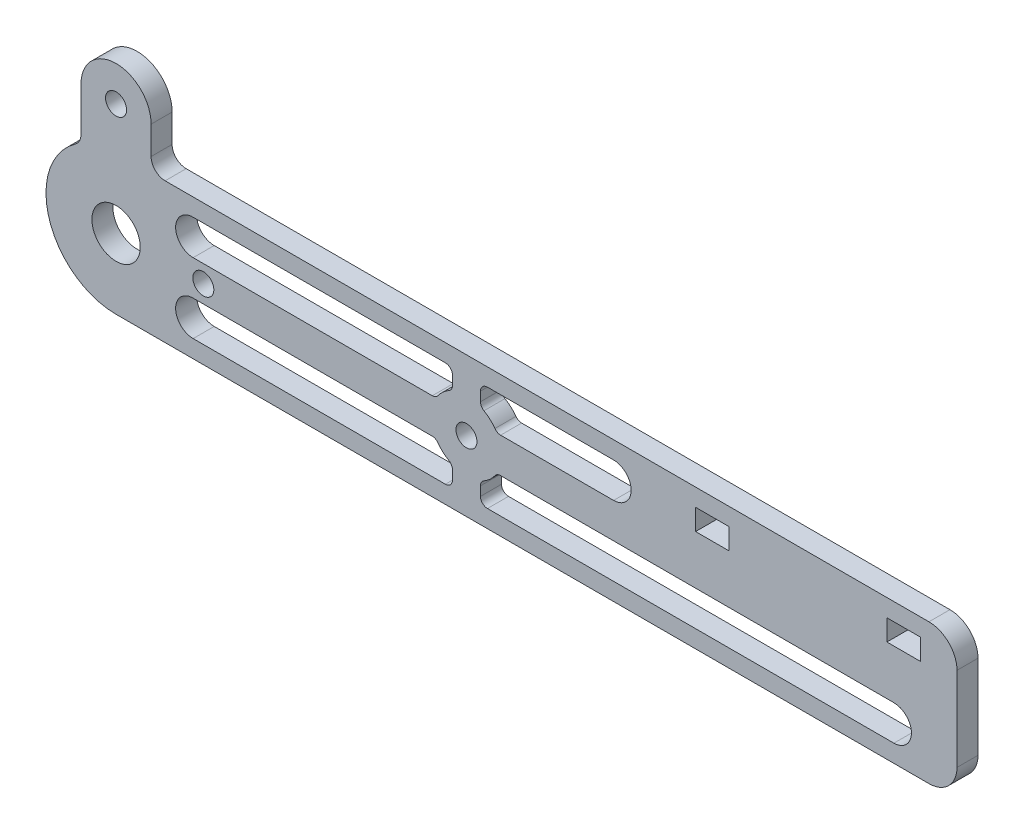
from build123d import *

# Parameters (mm, degrees)
BOSS_EXTRUDE1_DEPTH = 3
CUT_EXTRUDE1_REACH  = 122.453
SKETCH2_R           = 3.45
FILLET1_R           = 4
CUT_EXTRUDE2_REACH  = 122.453
SKETCH3_W           = 4.8
SKETCH3_H           = 3
CUT_EXTRUDE3_REACH  = 122.453
SKETCH5_R           = 1.5
BOSS_EXTRUDE2_DEPTH = 3
CUT_EXTRUDE4_REACH  = 122.453
SKETCH5_3_R         = 1.5
FILLET2_R           = 1
CUT_EXTRUDE5_REACH  = 122.453
SKETCH6_R           = 1.5
BOSS_EXTRUDE3_START = -3
SKETCH8_R           = 1.5
BOSS_EXTRUDE3_DEPTH = 3
FILLET3_R           = 2


with BuildPart() as part:
    # Sketch1 → Boss-Extrude1 (new body)
    with BuildSketch(Plane.XY):
        with BuildLine():
            Line((0, 10), (120, 10))
            Line((120, 10), (120, -10))
            Line((120, -10), (0, -10))
            ThreePointArc((0, -10), (-10, 0), (0, 10))
        make_face()
    extrude(amount=BOSS_EXTRUDE1_DEPTH)

    # Sketch2 → Cut-Extrude1 (cut, up to next)
    with BuildSketch(Plane.XY.offset(3), mode=Mode.PRIVATE) as cut_extrude1_sk1:
        Circle(SKETCH2_R)
    cut_extrude1_tool1 = extrude(cut_extrude1_sk1.sketch, amount=-CUT_EXTRUDE1_REACH, mode=Mode.PRIVATE) & part.part
    add(cut_extrude1_tool1.solids().sort_by_distance((0, 0, 3))[0], mode=Mode.SUBTRACT)

    # Fillet1
    fillet1_edges = [part.edges().sort_by_distance(p)[0] for p in [
        (120, 10, 1.5),
        (120, -10, 1.5),
    ]]
    fillet(fillet1_edges, radius=FILLET1_R)

    # Sketch3 → Cut-Extrude2 (cut, up to next)
    with BuildSketch(Plane.XY.offset(3), mode=Mode.PRIVATE) as cut_extrude2_sk1:
        with Locations((85.1, 6)):
            Rectangle(SKETCH3_W, SKETCH3_H)
    cut_extrude2_tool1 = extrude(cut_extrude2_sk1.sketch, amount=-CUT_EXTRUDE2_REACH, mode=Mode.PRIVATE) & part.part
    # Sketch3 → Cut-Extrude2 (cut, up to next)
    with BuildSketch(Plane.XY.offset(3), mode=Mode.PRIVATE) as cut_extrude2_sk2:
        with Locations((112.4, 6)):
            Rectangle(SKETCH3_W, SKETCH3_H)
    cut_extrude2_tool2 = extrude(cut_extrude2_sk2.sketch, amount=-CUT_EXTRUDE2_REACH, mode=Mode.PRIVATE) & part.part
    add(cut_extrude2_tool1.solids().sort_by_distance((85.1, 6, 3))[0], mode=Mode.SUBTRACT)
    add(cut_extrude2_tool2.solids().sort_by_distance((112.4, 6, 3))[0], mode=Mode.SUBTRACT)

    # Sketch4 → Cut-Extrude3 (cut, up to next)
    with BuildSketch(Plane.XY.offset(3), mode=Mode.PRIVATE) as cut_extrude3_sk1:
        with BuildLine():
            Line((11, 7.5), (71, 7.5))
            ThreePointArc((71, 7.5), (73.5, 5), (71, 2.5))
            Line((71, 2.5), (11, 2.5))
            ThreePointArc((11, 2.5), (8.5, 5), (11, 7.5))
        make_face()
    cut_extrude3_tool1 = extrude(cut_extrude3_sk1.sketch, amount=-CUT_EXTRUDE3_REACH, mode=Mode.PRIVATE) & part.part
    # Sketch4 → Cut-Extrude3 (cut, up to next)
    with BuildSketch(Plane.XY.offset(3), mode=Mode.PRIVATE) as cut_extrude3_sk2:
        with BuildLine():
            Line((11, -2.5), (111, -2.5))
            ThreePointArc((111, -2.5), (113.5, -5), (111, -7.5))
            Line((111, -7.5), (11, -7.5))
            ThreePointArc((11, -7.5), (8.5, -5), (11, -2.5))
        make_face()
    cut_extrude3_tool2 = extrude(cut_extrude3_sk2.sketch, amount=-CUT_EXTRUDE3_REACH, mode=Mode.PRIVATE) & part.part
    add(cut_extrude3_tool1.solids().sort_by_distance((41, 5, 3))[0], mode=Mode.SUBTRACT)
    add(cut_extrude3_tool2.solids().sort_by_distance((61, -5, 3))[0], mode=Mode.SUBTRACT)

    # Sketch5 → Boss-Extrude2 (add)
    # profile 1 of 3: a face of its own
    with BuildSketch(Plane.XY.offset(3)):
        with BuildLine():
            Line((52, 7.5), (48, 7.5))
            Line((48, 7.5), (48, 4.582575695))
            ThreePointArc((48, 4.582575695), (46.668047509, 3.728014565), (45.669872981, 2.5))
            Line((45.669872981, 2.5), (54.330127019, 2.5))
            ThreePointArc((54.330127019, 2.5), (53.331952491, 3.728014565), (52, 4.582575695))
            Line((52, 4.582575695), (52, 7.5))
        make_face()
    # profile 2 of 3: a face of its own
    with BuildSketch(Plane.XY.offset(3)):
        with BuildLine():
            Line((54.330127019, -2.5), (45.669872981, -2.5))
            ThreePointArc((45.669872981, -2.5), (46.668047509, -3.728014565), (48, -4.582575695))
            Line((48, -4.582575695), (48, -7.5))
            Line((48, -7.5), (52, -7.5))
            Line((52, -7.5), (52, -4.582575695))
            ThreePointArc((52, -4.582575695), (53.331952491, -3.728014565), (54.330127019, -2.5))
        make_face()
    # profile 3 of 3: a face of its own
    with BuildSketch(Plane.XY.offset(3)):
        with BuildLine():
            Line((54.330127019, 2.5), (45.669872981, 2.5))
            ThreePointArc((45.669872981, 2.5), (45, 0), (45.669872981, -2.5))
            Line((45.669872981, -2.5), (54.330127019, -2.5))
            ThreePointArc((54.330127019, -2.5), (55, 0), (54.330127019, 2.5))
        make_face()
        with Locations((50, 0)):
            Circle(SKETCH5_R, mode=Mode.SUBTRACT)
    extrude(amount=-BOSS_EXTRUDE2_DEPTH)

    # Sketch5<3> → Cut-Extrude4 (cut, up to next)
    with BuildSketch(Plane.XY.offset(3), mode=Mode.PRIVATE) as cut_extrude4_sk1:
        with Locations((50, 0)):
            Circle(SKETCH5_3_R)
    cut_extrude4_tool1 = extrude(cut_extrude4_sk1.sketch, amount=-CUT_EXTRUDE4_REACH, mode=Mode.PRIVATE) & part.part
    add(cut_extrude4_tool1.solids().sort_by_distance((50, 0, 3))[0], mode=Mode.SUBTRACT)

    # Fillet2
    fillet2_edges = [part.edges().sort_by_distance(p)[0] for p in [
        (52, 4.582575695, 1.5),
        (48, -4.582575695, 1.5),
        (48, -7.5, 1.5),
        (52, -7.5, 1.5),
        (52, -4.582575695, 1.5),
        (54.330127019, -2.5, 1.5),
        (52, 7.5, 1.5),
        (48, 7.5, 1.5),
        (48, 4.582575695, 1.5),
        (45.669872981, -2.5, 1.5),
        (45.669872981, 2.5, 1.5),
        (54.330127019, 2.5, 1.5),
    ]]
    fillet(fillet2_edges, radius=FILLET2_R)

    # Sketch6 → Cut-Extrude5 (cut, up to next)
    with BuildSketch(Plane(origin=(0, 0, 0), x_dir=(-1, 0, 0), z_dir=(0, 0, -1)), mode=Mode.PRIVATE) as cut_extrude5_sk1:
        with Locations((-12.45, 0)):
            Circle(SKETCH6_R)
    cut_extrude5_tool1 = extrude(cut_extrude5_sk1.sketch, amount=-CUT_EXTRUDE5_REACH, mode=Mode.PRIVATE) & part.part
    add(cut_extrude5_tool1.solids().sort_by_distance((12.45, 0, 0))[0], mode=Mode.SUBTRACT)

    # Sketch8 → Boss-Extrude3 (add)
    with BuildSketch(Plane.XY.offset(3).offset(BOSS_EXTRUDE3_START)):
        with BuildLine():
            Line((5, 16), (5, 10))
            Line((5, 10), (0, 10))
            ThreePointArc((0, 10), (-2.588190451, 9.659258263), (-5, 8.660254038))
            Line((-5, 8.660254038), (-5, 16))
            ThreePointArc((-5, 16), (0, 21), (5, 16))
        make_face()
        with Locations((0, 16)):
            Circle(SKETCH8_R, mode=Mode.SUBTRACT)
    extrude(amount=BOSS_EXTRUDE3_DEPTH)

    # Fillet3
    fillet3_edges = [part.edges().sort_by_distance(p)[0] for p in [
        (5, 10, 1.5),
        (-5, 8.660254038, 1.5),
    ]]
    fillet(fillet3_edges, radius=FILLET3_R)


solid = part.part
